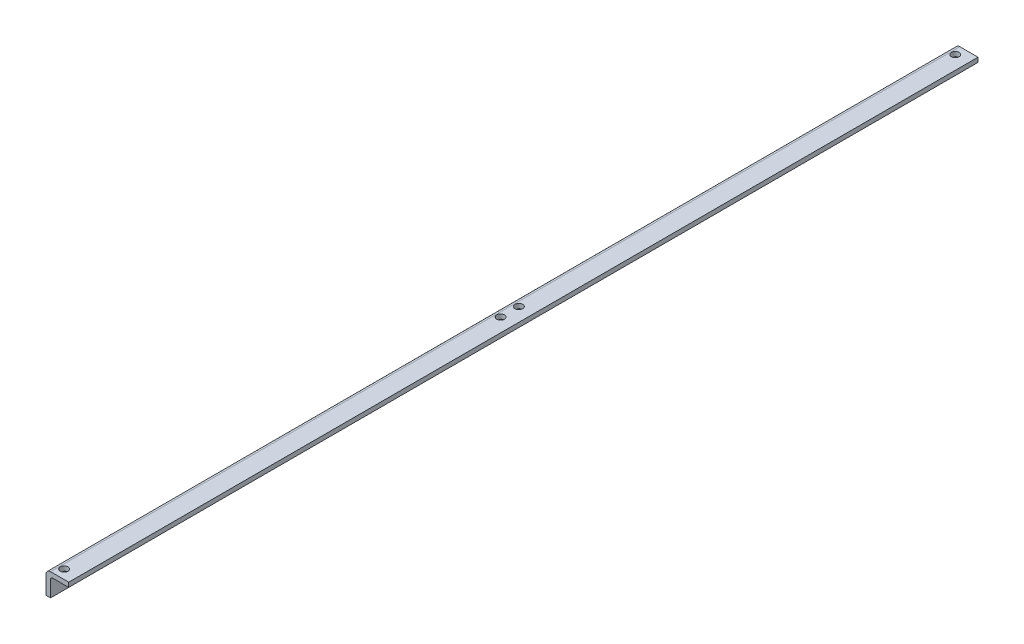
from build123d import *

# Parameters (mm, degrees)
EXTRUDE_1_DEPTH     = 400
SKETCH_2_R          = 1.7
CUT_EXTRUDE_1_DEPTH = 5
SKETCH_3_R          = 1.7
CUT_EXTRUDE_2_DEPTH = 5


with BuildPart() as part:
    # Эскиз1 → Вытянуть1 (new body)
    with BuildSketch(Plane.XY):
        with BuildLine():
            Line((0, 0), (2, 0))
            Line((2, 0), (2, 7))
            ThreePointArc((2, 7), (2.292893219, 7.707106781), (3, 8))
            Line((3, 8), (10, 8))
            Line((10, 8), (10, 10))
            Line((10, 10), (2, 10))
            ThreePointArc((2, 10), (0.585786438, 9.414213562), (0, 8))
            Line((0, 8), (0, 0))
        make_face()
    extrude(amount=EXTRUDE_1_DEPTH)

    # Эскиз2 → Вырез-Вытянуть1 (cut)
    with BuildSketch(Plane(origin=(0, 10, 0), x_dir=(-1, 0, 0), z_dir=(0, 1, 0))):
        with Locations(Location((-4, 396, 0), (0, 0, 90))):
            Circle(SKETCH_2_R)
        with Locations(Location((-4, 4, 0), (0, 0, 53.968120928))):
            Circle(SKETCH_2_R)
        with Locations(Location((-4, 204, 0), (0, 0, 53.968120928))):
            Circle(SKETCH_2_R)
        with Locations(Location((-4, 196, 0), (0, 0, 90))):
            Circle(SKETCH_2_R)
    extrude(amount=-CUT_EXTRUDE_1_DEPTH, mode=Mode.SUBTRACT)

    # Эскиз3 → Вырез-Вытянуть2 (cut)
    with BuildSketch(Plane.ZY):
        with Locations((388, 4)):
            Circle(SKETCH_3_R)
        with Locations((380, 4)):
            Circle(SKETCH_3_R)
        with Locations((20, 4)):
            Circle(SKETCH_3_R)
        with Locations((12, 4)):
            Circle(SKETCH_3_R)
    extrude(amount=-CUT_EXTRUDE_2_DEPTH, mode=Mode.SUBTRACT)


solid = part.part
